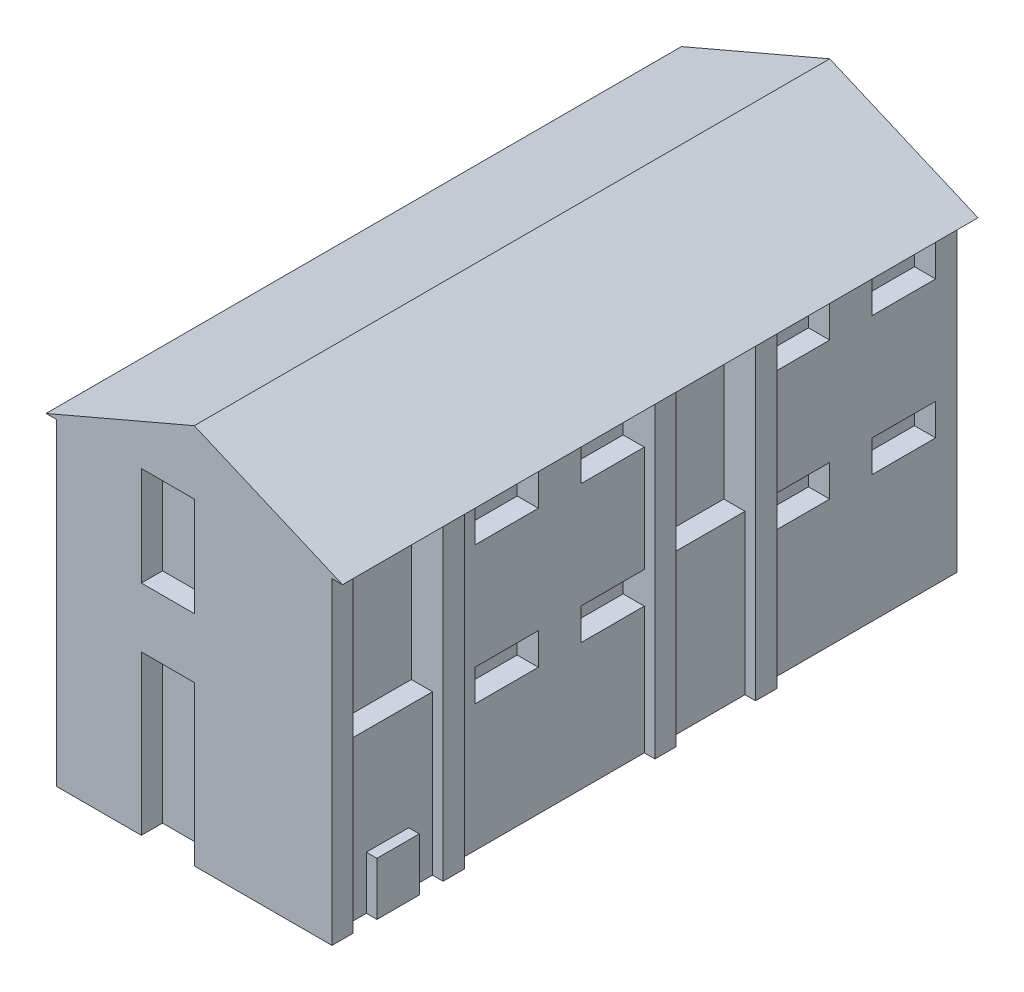
from build123d import *

# Parameters (mm, degrees)
SALIENTE_EXTRUIR1_DEPTH = 30
CROQUIS2_W              = 1
CROQUIS2_H              = 15
SALIENTE_EXTRUIR2_DEPTH = 0.5
CROQUIS3_W              = 1
CROQUIS3_H              = 15
SALIENTE_EXTRUIR3_DEPTH = 0.5
CROQUIS3_3_W            = 4.245899855
CROQUIS3_3_H            = 6.5
CROQUIS3_3_W_2          = 3
CROQUIS3_3_H_2          = 1.5
CROQUIS3_3_W_3          = 3.754100145
CORTAR_EXTRUIR1_DEPTH   = 1
CROQUIS3_4_W            = 2
CROQUIS3_4_H            = 2.5
SALIENTE_EXTRUIR4_DEPTH = 0.5
CROQUIS7_W              = 1
CROQUIS7_H              = 15
SALIENTE_EXTRUIR5_DEPTH = 0.5
CROQUIS8_W              = 2.5
CROQUIS8_H              = 7.5
CROQUIS8_H_2            = 4.684108695
CORTAR_EXTRUIR2_DEPTH   = 1
CROQUIS10_W             = 1
CROQUIS10_H             = 15
CROQUIS10_W_2           = 2
SALIENTE_EXTRUIR6_DEPTH = 0.5
CROQUIS11_W             = 2.5
CROQUIS11_H             = 5.5
CORTAR_EXTRUIR3_DEPTH   = 1
CROQUIS12_W             = 3.5
CROQUIS12_H             = 6.5
CROQUIS12_H_2           = 2
CROQUIS12_W_2           = 2.5
CROQUIS12_H_3           = 5.5
CORTAR_EXTRUIR4_DEPTH   = 1
CROQUIS13_R             = 1.575
CORTAR_EXTRUIR5_DEPTH   = 2.5


with BuildPart() as part:
    # Croquis1 → Saliente-Extruir1 (new body)
    with BuildSketch(Plane.XY):
        Polygon((-6, -7.5), (6, -7.5), (6, 7.5), (7, 7.5), (0, 10.5), (-7, 7.5), (-6, 7.5), align=None)
    extrude(amount=SALIENTE_EXTRUIR1_DEPTH)

    # Croquis2 → Saliente-Extruir2 (add)
    with BuildSketch(Plane(origin=(6, 0, 0), x_dir=(0, 0, -1), z_dir=(1, 0, 0))):
        with Locations((-29.5, 0)):
            Rectangle(CROQUIS2_W, CROQUIS2_H)
        with Locations((-24.254100145, 0)):
            Rectangle(CROQUIS2_W, CROQUIS2_H)
    extrude(amount=SALIENTE_EXTRUIR2_DEPTH)

    # Croquis3 → Saliente-Extruir3 (add)
    with BuildSketch(Plane(origin=(6, 0, 0), x_dir=(0, 0, -1), z_dir=(1, 0, 0))):
        with Locations((-14.254100145, 0)):
            Rectangle(CROQUIS3_W, CROQUIS3_H)
        with Locations((-9.5, 0)):
            Rectangle(CROQUIS3_W, CROQUIS3_H)
    extrude(amount=SALIENTE_EXTRUIR3_DEPTH)

    # Croquis3<3> → Cortar-Extruir1 (cut)
    with BuildSketch(Plane(origin=(6, 0, 0), x_dir=(0, 0, -1), z_dir=(1, 0, 0))):
        with Locations((-26.877050073, 3.25)):
            Rectangle(CROQUIS3_3_W, CROQUIS3_3_H)
        with Locations((-21.254100145, 5.75)):
            Rectangle(CROQUIS3_3_W_2, CROQUIS3_3_H_2)
        with Locations((-16.254100145, 5.75)):
            Rectangle(CROQUIS3_3_W_2, CROQUIS3_3_H_2)
        with Locations((-16.254100145, -0.75)):
            Rectangle(CROQUIS3_3_W_2, CROQUIS3_3_H_2)
        with Locations((-11.877050073, 3.25)):
            Rectangle(CROQUIS3_3_W_3, CROQUIS3_3_H)
        with Locations((-7.5, 5.75)):
            Rectangle(CROQUIS3_3_W_2, CROQUIS3_3_H_2)
        with Locations((-7.5, -0.75)):
            Rectangle(CROQUIS3_3_W_2, CROQUIS3_3_H_2)
        with Locations((-2.5, 5.75)):
            Rectangle(CROQUIS3_3_W_2, CROQUIS3_3_H_2)
        with Locations((-21.254100145, -0.75)):
            Rectangle(CROQUIS3_3_W_2, CROQUIS3_3_H_2)
        with Locations((-2.5, -0.75)):
            Rectangle(CROQUIS3_3_W_2, CROQUIS3_3_H_2)
    extrude(amount=-CORTAR_EXTRUIR1_DEPTH, mode=Mode.SUBTRACT)

    # Croquis3<4> → Saliente-Extruir4 (add)
    with BuildSketch(Plane(origin=(6, 0, 0), x_dir=(0, 0, -1), z_dir=(1, 0, 0))):
        with Locations((-26.877050072, -6.25)):
            Rectangle(CROQUIS3_4_W, CROQUIS3_4_H)
    extrude(amount=SALIENTE_EXTRUIR4_DEPTH)

    # Croquis7 → Saliente-Extruir5 (add)
    with BuildSketch(Plane.ZY.offset(6)):
        with Locations((29.5, 0)):
            Rectangle(CROQUIS7_W, CROQUIS7_H)
    extrude(amount=SALIENTE_EXTRUIR5_DEPTH)

    # Croquis8 → Cortar-Extruir2 (cut)
    with BuildSketch(Plane.XY.offset(30)):
        with Locations((-1.25, -3.75)):
            Rectangle(CROQUIS8_W, CROQUIS8_H)
        with Locations((-1.25, 5.157945653)):
            Rectangle(CROQUIS8_W, CROQUIS8_H_2)
    extrude(amount=-CORTAR_EXTRUIR2_DEPTH, mode=Mode.SUBTRACT)

    # Croquis10 → Saliente-Extruir6 (add)
    with BuildSketch(Plane.ZY.offset(6)):
        with Locations((0.5, 0)):
            Rectangle(CROQUIS10_W, CROQUIS10_H)
        with Locations((13.5, 0)):
            Rectangle(CROQUIS10_W_2, CROQUIS10_H)
    extrude(amount=SALIENTE_EXTRUIR6_DEPTH)

    # Croquis11 → Cortar-Extruir3 (cut)
    with BuildSketch(Plane.ZY.offset(6)):
        with Locations((6.75, 3.75)):
            Rectangle(CROQUIS11_W, CROQUIS11_H)
        with Locations((2.25, 3.75)):
            Rectangle(CROQUIS11_W, CROQUIS11_H)
        with Locations((11.25, 3.75)):
            Rectangle(CROQUIS11_W, CROQUIS11_H)
        with Locations((6.75, -3.75)):
            Rectangle(CROQUIS11_W, CROQUIS11_H)
        with Locations((11.25, -3.75)):
            Rectangle(CROQUIS11_W, CROQUIS11_H)
        with Locations((2.25, -3.75)):
            Rectangle(CROQUIS11_W, CROQUIS11_H)
    extrude(amount=-CORTAR_EXTRUIR3_DEPTH, mode=Mode.SUBTRACT)

    # Croquis12 → Cortar-Extruir4 (cut)
    with BuildSketch(Plane.ZY.offset(6)):
        with Locations((16.25, -4.25)):
            Rectangle(CROQUIS12_W, CROQUIS12_H)
        with Locations((16.25, 5.5)):
            Rectangle(CROQUIS12_W, CROQUIS12_H_2)
        with Locations((21.25, 3.75)):
            Rectangle(CROQUIS12_W_2, CROQUIS12_H_3)
        with Locations((25.75, 3.75)):
            Rectangle(CROQUIS12_W_2, CROQUIS12_H_3)
        with Locations((21.25, -3.75)):
            Rectangle(CROQUIS12_W_2, CROQUIS12_H_3)
        with Locations((25.75, -3.75)):
            Rectangle(CROQUIS12_W_2, CROQUIS12_H_3)
    extrude(amount=-CORTAR_EXTRUIR4_DEPTH, mode=Mode.SUBTRACT)

    # Croquis13 → Cortar-Extruir5 (cut)
    with BuildSketch(Plane.XZ.offset(7.5)):
        with Locations((-0.12745098, 14.705882353)):
            Circle(CROQUIS13_R)
    extrude(amount=-CORTAR_EXTRUIR5_DEPTH, mode=Mode.SUBTRACT)


solid = part.part
